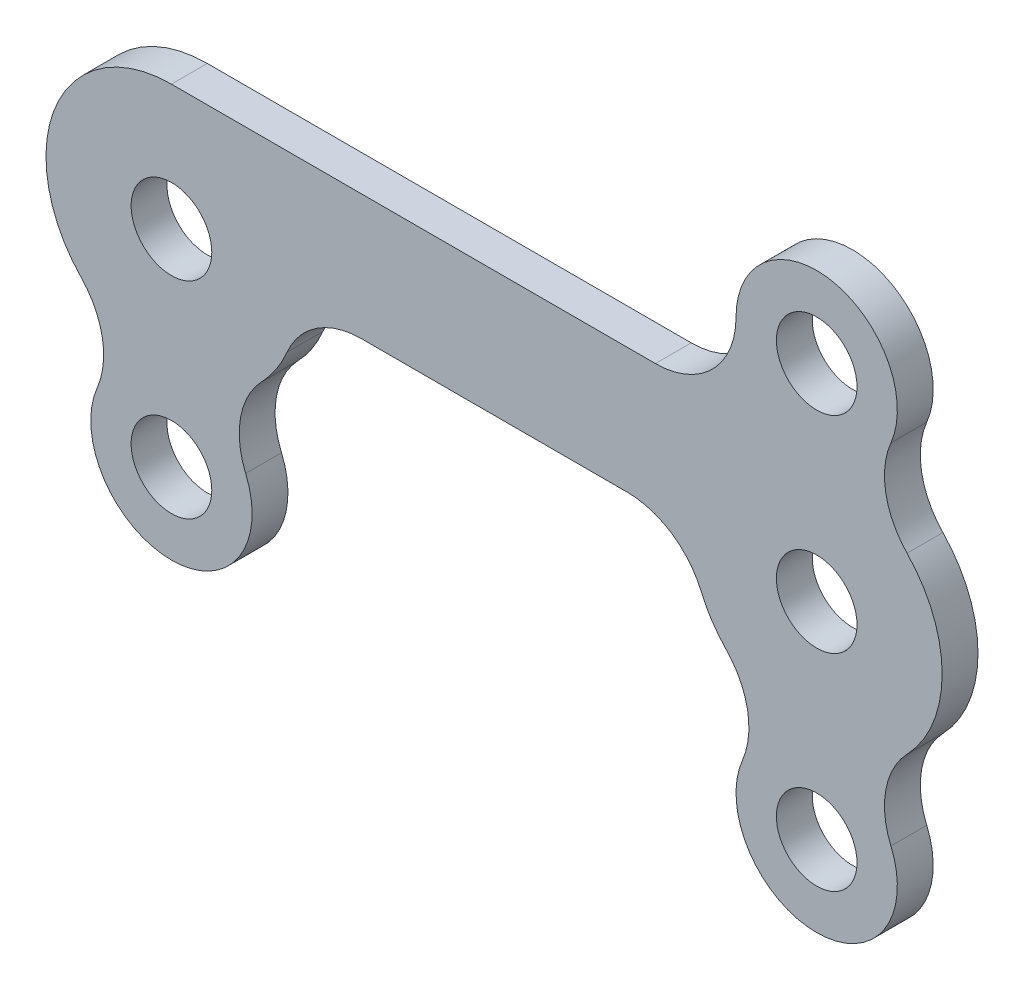
from build123d import *

# Parameters (mm, degrees)
SKETCH1_R           = 1.7859375
SKETCH1_R_2         = 3.571875
BOSS_EXTRUDE1_DEPTH = 1.5875
FILLET1_R           = 3.571875


with BuildPart() as part:
    # Sketch1 → Boss-Extrude1 (new body)
    # profile 1 of 10: a face of its own
    with BuildSketch(Plane.XY):
        with BuildLine():
            Line((5.55625, 0), (23.01875, 0))
            ThreePointArc((23.01875, 0), (24.646137947, -3.928862053), (28.575, -5.55625))
            ThreePointArc((28.575, -5.55625), (34.13125, 0), (28.575, 5.55625))
            Line((28.575, 5.55625), (0, 5.55625))
            ThreePointArc((0, 5.55625), (-5.55625, 0), (0, -5.55625))
            ThreePointArc((0, -5.55625), (3.928862053, -3.928862053), (5.55625, 0))
        make_face()
        Circle(SKETCH1_R, mode=Mode.SUBTRACT)
        with Locations((28.575, 0)):
            Circle(SKETCH1_R, mode=Mode.SUBTRACT)
    # profile 2 of 10: a face of its own
    with BuildSketch(Plane.XY):
        with Locations((0, -9.128125)):
            Circle(SKETCH1_R_2)
        with Locations((0, -9.128125)):
            Circle(SKETCH1_R, mode=Mode.SUBTRACT)
    # profile 3 of 10: a face of its own
    with BuildSketch(Plane.XY):
        with Locations((28.575, -9.128125)):
            Circle(SKETCH1_R_2)
        with Locations((28.575, -9.128125)):
            Circle(SKETCH1_R, mode=Mode.SUBTRACT)
    # profile 4 of 10: a face of its own
    with BuildSketch(Plane.XY):
        with Locations((28.575, 9.128125)):
            Circle(SKETCH1_R_2)
        with Locations((28.575, 9.128125)):
            Circle(SKETCH1_R, mode=Mode.SUBTRACT)
    # profile 5 of 10: a face of its own
    with BuildSketch(Plane.XY):
        with BuildLine():
            ThreePointArc((25.003125, 9.128125), (23.956947034, 6.602427966), (21.43125, 5.55625))
            Line((21.43125, 5.55625), (28.575, 5.55625))
            ThreePointArc((28.575, 5.55625), (26.049302966, 6.602427966), (25.003125, 9.128125))
        make_face()
    # profile 6 of 10: a face of its own
    with BuildSketch(Plane.XY):
        with BuildLine():
            ThreePointArc((28.575, 5.55625), (30.749184671, 5.113202038), (32.576636172, 3.854714258))
            ThreePointArc((32.576636172, 3.854714258), (31.636446643, 5.685103409), (31.862058392, 7.730434711))
            ThreePointArc((31.862058392, 7.730434711), (30.545522268, 6.148975288), (28.575, 5.55625))
        make_face()
    # profile 7 of 10: a face of its own
    with BuildSketch(Plane.XY):
        with BuildLine():
            ThreePointArc((32.576636369, -3.854714053), (30.749184802, -5.113201982), (28.575, -5.55625))
            ThreePointArc((28.575, -5.55625), (30.545522308, -6.148975314), (31.862058429, -7.730434799))
            ThreePointArc((31.862058429, -7.730434799), (31.63644666, -5.685103316), (32.576636369, -3.854714053))
        make_face()
    # profile 8 of 10: a face of its own
    with BuildSketch(Plane.XY):
        with BuildLine():
            ThreePointArc((28.575, -5.55625), (26.400815226, -5.113201994), (24.573363672, -3.854714096))
            ThreePointArc((24.573363672, -3.854714096), (25.31350069, -4.996759504), (25.572758155, -6.332744565))
            ThreePointArc((25.572758155, -6.332744565), (25.500829783, -7.045951839), (25.287941573, -7.730434795))
            ThreePointArc((25.287941573, -7.730434795), (26.604477695, -6.148975313), (28.575, -5.55625))
        make_face()
    # profile 9 of 10: a face of its own
    with BuildSketch(Plane.XY):
        with BuildLine():
            ThreePointArc((3.287058429, -7.730434799), (3.061446657, -5.685103333), (4.001636346, -3.854714077))
            ThreePointArc((4.001636346, -3.854714077), (2.174184787, -5.113201989), (0, -5.55625))
            ThreePointArc((0, -5.55625), (1.970522308, -6.148975314), (3.287058429, -7.730434799))
        make_face()
    # profile 10 of 10: a face of its own
    with BuildSketch(Plane.XY):
        with BuildLine():
            ThreePointArc((-3.287058419, -7.730434774), (-1.970522296, -6.148975307), (0, -5.55625))
            ThreePointArc((0, -5.55625), (-2.174184701, -5.113202025), (-4.001636217, -3.854714211))
            ThreePointArc((-4.001636217, -3.854714211), (-3.26149928, -4.996759577), (-3.002241845, -6.332744565))
            ThreePointArc((-3.002241845, -6.332744565), (-3.074170214, -7.045951828), (-3.287058419, -7.730434774))
        make_face()
    extrude(amount=BOSS_EXTRUDE1_DEPTH)

    # Fillet1
    fillet1_edges = [part.edges().sort_by_distance(p)[0] for p in [
        (23.01875, 0, 0.79375),
        (5.55625, 0, 0.79375),
    ]]
    fillet(fillet1_edges, radius=FILLET1_R)


solid = part.part
